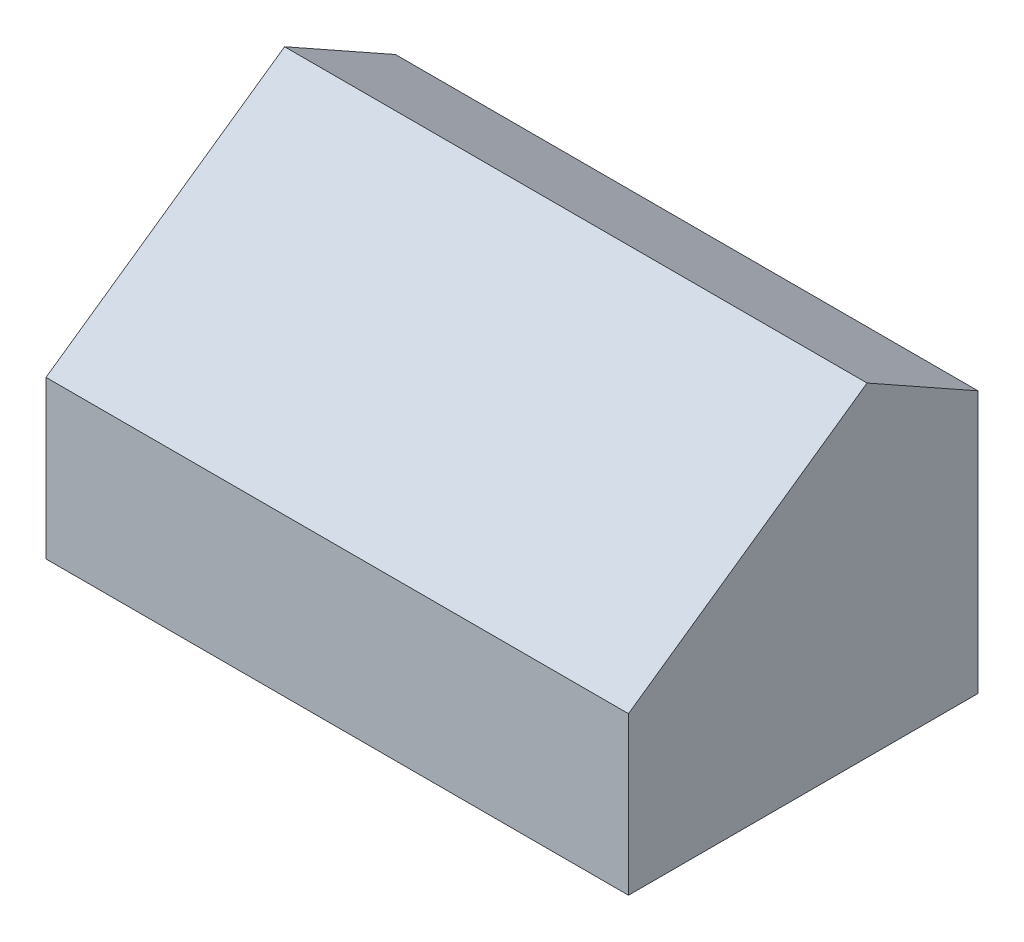
from build123d import *

# Parameters (mm, degrees)
BOSS_EXTRUDE1_DEPTH = 100


with BuildPart() as part:
    # Sketch1 → Boss-Extrude1 (new body)
    with BuildSketch(Plane(origin=(0, 0, 0), x_dir=(0, 0, -1), z_dir=(1, 0, 0))):
        Polygon((0, 0), (0, 27), (40.957602214, 55.678821818), (60, 45), (60, 0), align=None)
    extrude(amount=BOSS_EXTRUDE1_DEPTH)


solid = part.part
